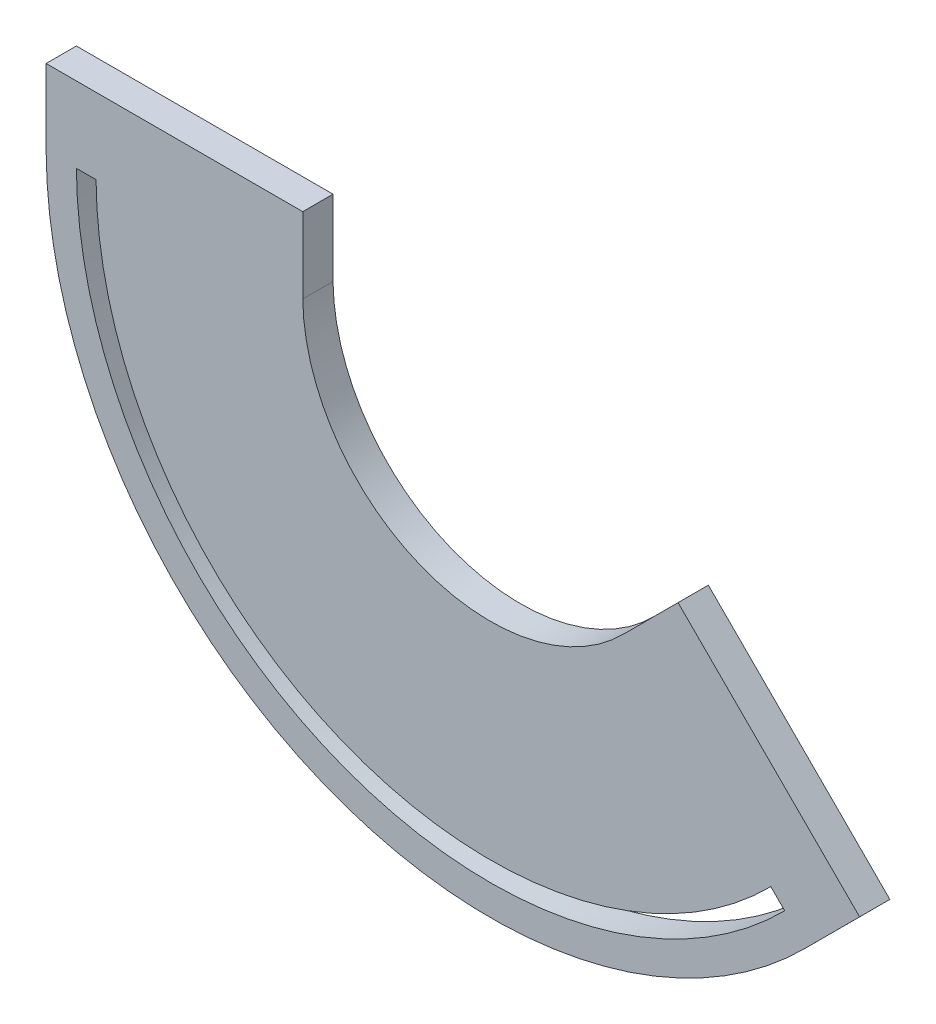
from build123d import *

# Parameters (mm, degrees)
BOSS_EXTRUDE3_DEPTH = 5.08
CUT_EXTRUDE1_DEPTH  = 106.587982078


with BuildPart() as part:
    # Sketch2 → Boss-Extrude3 (new body)
    with BuildSketch(Plane.XY):
        with BuildLine():
            Line((22.537725188, -22.001112684), (31.51476314, -13.017639546))
            Line((31.51476314, -13.017639546), (61.988715036, -43.46976185))
            Line((61.988715036, -43.46976185), (53.011677084, -52.453234987))
            ThreePointArc((53.011677084, -52.453234987), (-28.180925595, -69.046471311), (-74.575034639, -0.379442341))
            Line((-74.575034639, -0.379442341), (-74.575034639, 12.320557659))
            Line((-74.575034639, 12.320557659), (-31.493714286, 12.320557659))
            Line((-31.493714286, 12.320557659), (-31.493714286, -0.379442341))
            ThreePointArc((-31.493714286, -0.379442341), (-11.701563668, -29.241604329), (22.537725188, -22.001112684))
        make_face()
    extrude(amount=BOSS_EXTRUDE3_DEPTH)

    # Sketch5 → Cut-Extrude1 (cut, through all)
    with BuildSketch(Plane.XY.offset(5.08)):
        with BuildLine():
            Line((-69.495034639, -0.379442341), (-66.193034639, -0.379442341))
            ThreePointArc((-66.193034639, -0.379442341), (-24.974661813, -61.301941883), (47.08258988, -46.528395002))
            Line((47.08258988, -46.528395002), (49.418290754, -48.862422729))
            ThreePointArc((49.418290754, -48.862422729), (-26.237735384, -64.352817016), (-69.495034639, -0.379442341))
        make_face()
    extrude(amount=-CUT_EXTRUDE1_DEPTH, mode=Mode.SUBTRACT)


solid = part.part
